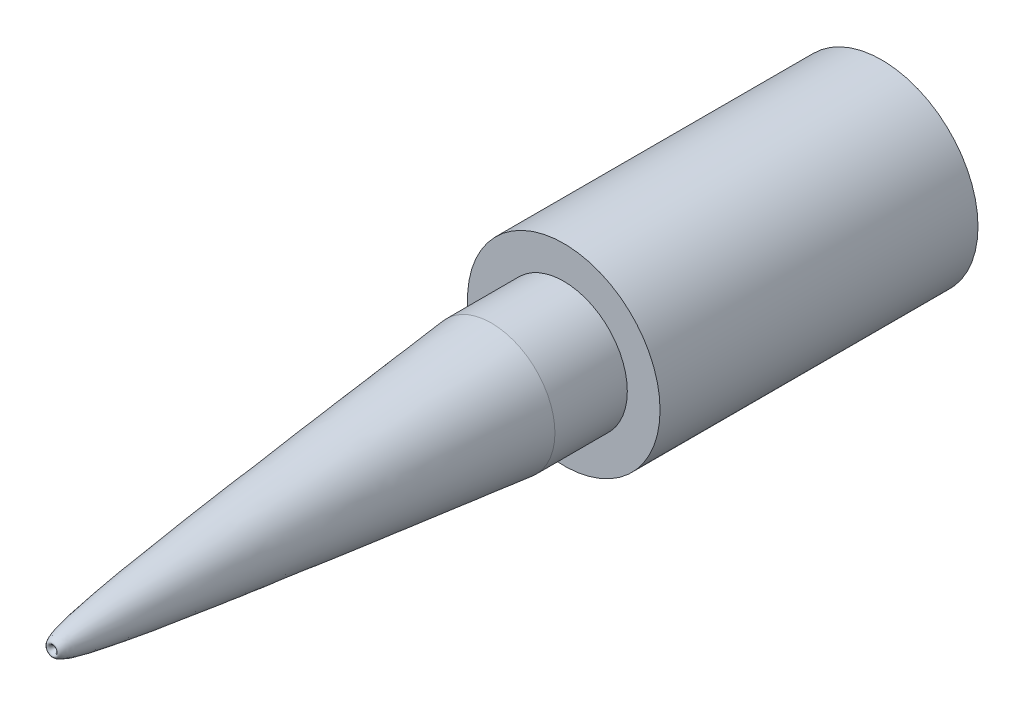
from build123d import *

# Parameters (mm, degrees)
SKETCH1_R           = 9.6
BOSS_EXTRUDE1_DEPTH = 31.71
SKETCH4_R           = 8.42
CUT_EXTRUDE1_DEPTH  = 3.01
SKETCH5_R           = 7.185
CUT_EXTRUDE3_DEPTH  = 12.61
SKETCH6_R           = 2
BOSS_EXTRUDE2_DEPTH = 9.58
CHAMFER1_SIZE       = 1.33
SKETCH7_R           = 6.335
BOSS_EXTRUDE3_DEPTH = 7.22


with BuildPart() as part:
    # Sketch1 → Boss-Extrude1 (new body)
    with BuildSketch(Plane.XY):
        Circle(SKETCH1_R)
    extrude(amount=BOSS_EXTRUDE1_DEPTH)

    # Sketch4 → Cut-Extrude1 (cut)
    with BuildSketch(Plane(origin=(0, 0, 0), x_dir=(-1, 0, 0), z_dir=(0, 0, -1))):
        Circle(SKETCH4_R)
    extrude(amount=-CUT_EXTRUDE1_DEPTH, mode=Mode.SUBTRACT)

    # Sketch5 → Cut-Extrude3 (cut)
    with BuildSketch(Plane(origin=(0, 0, 3.01), x_dir=(-1, 0, 0), z_dir=(0, 0, -1))):
        Circle(SKETCH5_R)
    extrude(amount=-CUT_EXTRUDE3_DEPTH, mode=Mode.SUBTRACT)

    # Sketch6 → Boss-Extrude2 (add)
    with BuildSketch(Plane(origin=(0, 0, 15.62), x_dir=(-1, 0, 0), z_dir=(0, 0, -1))):
        Circle(SKETCH6_R)
    extrude(amount=BOSS_EXTRUDE2_DEPTH)

    # Chamfer1
    chamfer1_edges = [part.edges().sort_by_distance(p)[0] for p in [
        (2, 0, 6.04),
    ]]
    chamfer(chamfer1_edges, length=CHAMFER1_SIZE)

    # Sketch7 → Boss-Extrude3 (add)
    with BuildSketch(Plane.XY.offset(31.71)):
        Circle(SKETCH7_R)
    extrude(amount=BOSS_EXTRUDE3_DEPTH)

    # Sketch10 → Revolve2 (revolve)
    with BuildSketch(Plane(origin=(0, 0, 0), x_dir=(0, 0, -1), z_dir=(1, 0, 0))):
        with BuildLine():
            Line((-81.78, 0), (-38.93, 0))
            Line((-38.93, 0), (-38.93, 6.335))
            add(Edge.make_bspline(
                [(-38.93, 6.335), (-86.441299856, 1.360959474), (-81.78, 0)],
                knots=[0, 0, 0, 1, 1, 1], degree=2, weights=[1, 1.745276846, 1]))
        make_face()
    revolve(axis=Axis((0, 0, 81.78), (0, 0, -1)))


solid = part.part
